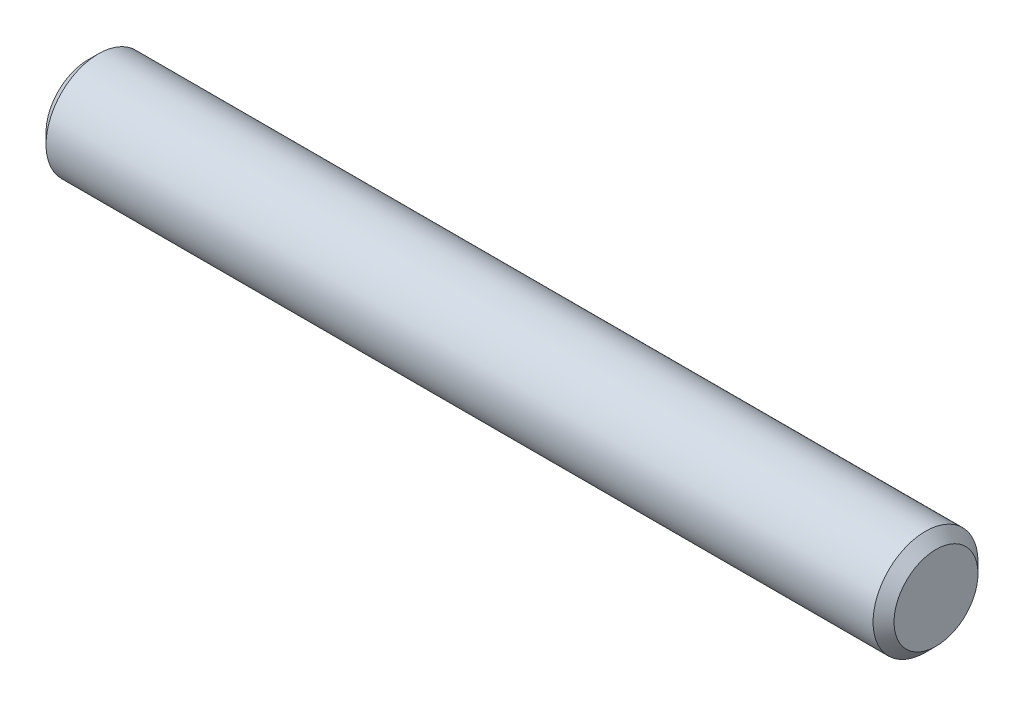
from build123d import *

# Parameters (mm, degrees)
SKETCH1_R           = 5
BOSS_EXTRUDE1_DEPTH = 80.8
CHAMFER1_SIZE       = 1


with BuildPart() as part:
    # Sketch1 → Boss-Extrude1 (new body)
    with BuildSketch(Plane(origin=(0, 0, 0), x_dir=(0, 0, -1), z_dir=(1, 0, 0))):
        Circle(SKETCH1_R)
    extrude(amount=BOSS_EXTRUDE1_DEPTH)

    # Chamfer1
    chamfer1_edges = [part.edges().sort_by_distance(p)[0] for p in [
        (0, 0, 5),
        (80.8, 0, 5),
    ]]
    chamfer(chamfer1_edges, length=CHAMFER1_SIZE)


solid = part.part
